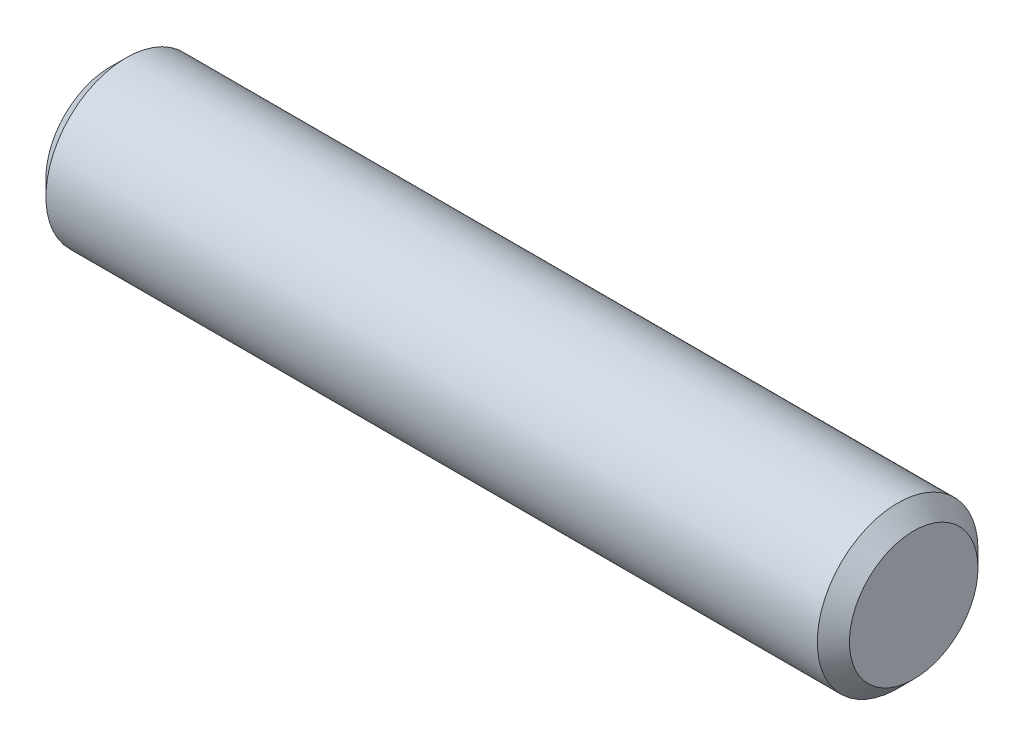
from build123d import *

# Parameters (mm, degrees)
EXTRUDE1_DEPTH      = 63.5
EXTRUDE1_DEPTH_BACK = 63.5
SKETCH2_R           = 12.7
CHAMFER1_SIZE       = 2.54


with BuildPart() as part:
    # Sketch2 → Extrude1 (new, two sides: drawn at the far end of the back side and taken through both)
    with BuildSketch(Plane(origin=(0, 0, 0), x_dir=(0, 0, -1), z_dir=(1, 0, 0)).offset(-EXTRUDE1_DEPTH_BACK)):
        Circle(SKETCH2_R)
    extrude(amount=EXTRUDE1_DEPTH + EXTRUDE1_DEPTH_BACK)

    # Chamfer1
    chamfer1_edges = [part.edges().sort_by_distance(p)[0] for p in [
        (-63.5, 0, 12.7),
        (63.5, 0, 12.7),
    ]]
    chamfer(chamfer1_edges, length=CHAMFER1_SIZE)


solid = part.part
